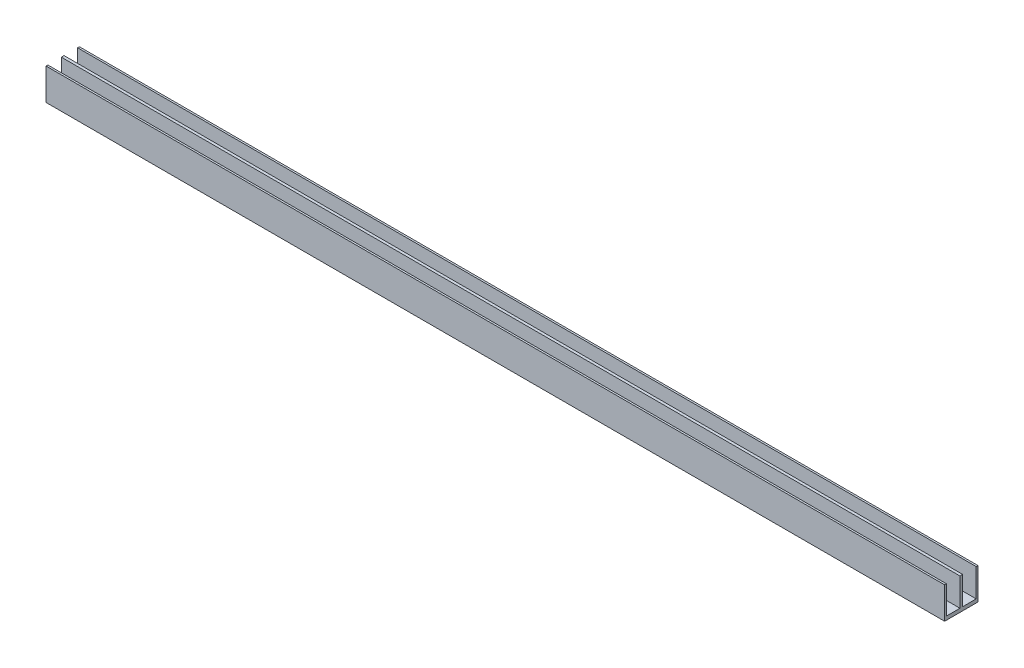
from build123d import *

# Parameters (mm, degrees)
SKETCH2_W           = 1000
SKETCH2_H           = 37
BOSS_EXTRUDE1_DEPTH = 35
SKETCH3_W           = 1000
SKETCH3_H           = 15
CUT_EXTRUDE1_DEPTH  = 31
SKETCH4_W           = 4
SKETCH4_H           = 35
CUT_EXTRUDE2_DEPTH  = 190


with BuildPart() as part:
    # Sketch2 → Boss-Extrude1 (new body)
    with BuildSketch(Plane(origin=(0, 0, 0), x_dir=(1, 0, 0), z_dir=(0, 1, 0))):
        with Locations((-35.123966942, 189.144628099)):
            Rectangle(SKETCH2_W, SKETCH2_H)
    extrude(amount=BOSS_EXTRUDE1_DEPTH)

    # Sketch3 → Cut-Extrude1 (cut)
    with BuildSketch(Plane(origin=(0, 35, 0), x_dir=(1, 0, 0), z_dir=(0, 1, 0))):
        with Locations((-35.123966942, 198.144628099)):
            Rectangle(SKETCH3_W, SKETCH3_H)
        with Locations((-35.123966942, 180.144628099)):
            Rectangle(SKETCH3_W, SKETCH3_H)
    extrude(amount=-CUT_EXTRUDE1_DEPTH, mode=Mode.SUBTRACT)

    # Sketch4 → Cut-Extrude2 (cut)
    with BuildSketch(Plane(origin=(0, 0, -207.644628099), x_dir=(-1, 0, 0), z_dir=(0, 0, -1))):
        with Locations((533.123966942, 17.5)):
            Rectangle(SKETCH4_W, SKETCH4_H)
    extrude(amount=-CUT_EXTRUDE2_DEPTH, mode=Mode.SUBTRACT)


solid = part.part
